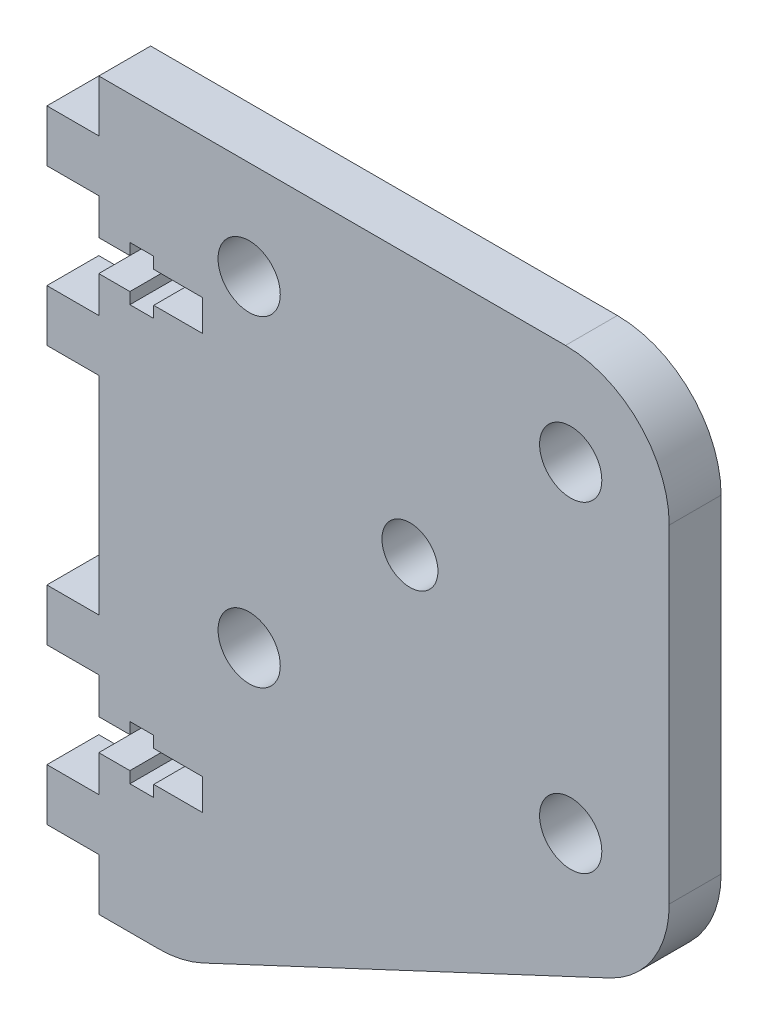
from build123d import *

# Parameters (mm, degrees)
SKETCH1_R           = 3
SKETCH1_R_2         = 2.7
BOSS_EXTRUDE1_DEPTH = 5
FILLET1_R           = 10


with BuildPart() as part:
    # Sketch1 → Boss-Extrude1 (new body)
    with BuildSketch(Plane.XY):
        Polygon((-25, 22), (-25, 70), (-80, 70), (-80, 65), (-85, 65), (-85, 60), (-80, 60), (-80, 56.5), (-77, 56.5), (-77, 57.6), (-74.7, 57.6), (-74.7, 56.5), (-70, 56.5), (-70, 53.5), (-74.7, 53.5), (-74.7, 52.4), (-77, 52.4), (-77, 53.5), (-80, 53.5), (-80, 50), (-85, 50), (-85, 45), (-80, 45), (-80, 25), (-85, 25), (-85, 20), (-80, 20), (-80, 16.5), (-77, 16.5), (-77, 17.6), (-74.7, 17.6), (-74.7, 16.5), (-70, 16.5), (-70, 13.5), (-74.7, 13.5), (-74.7, 12.4), (-77, 12.4), (-77, 13.5), (-80, 13.5), (-80, 10), (-85, 10), (-85, 5), (-80, 5), (-80, 0), (-72, 0), align=None)
        with Locations((-65.5, 29.5)):
            Circle(SKETCH1_R, mode=Mode.SUBTRACT)
        with Locations((-34.5, 29.5)):
            Circle(SKETCH1_R, mode=Mode.SUBTRACT)
        with Locations((-50, 45)):
            Circle(SKETCH1_R_2, mode=Mode.SUBTRACT)
        with Locations((-65.5, 60.5)):
            Circle(SKETCH1_R, mode=Mode.SUBTRACT)
        with Locations((-34.5, 60.5)):
            Circle(SKETCH1_R, mode=Mode.SUBTRACT)
    extrude(amount=BOSS_EXTRUDE1_DEPTH)

    # Fillet1
    fillet1_edges = [part.edges().sort_by_distance(p)[0] for p in [
        (-72, 0, 2.5),
        (-25, 70, 2.5),
        (-25, 22, 2.5),
    ]]
    fillet(fillet1_edges, radius=FILLET1_R)


solid = part.part
